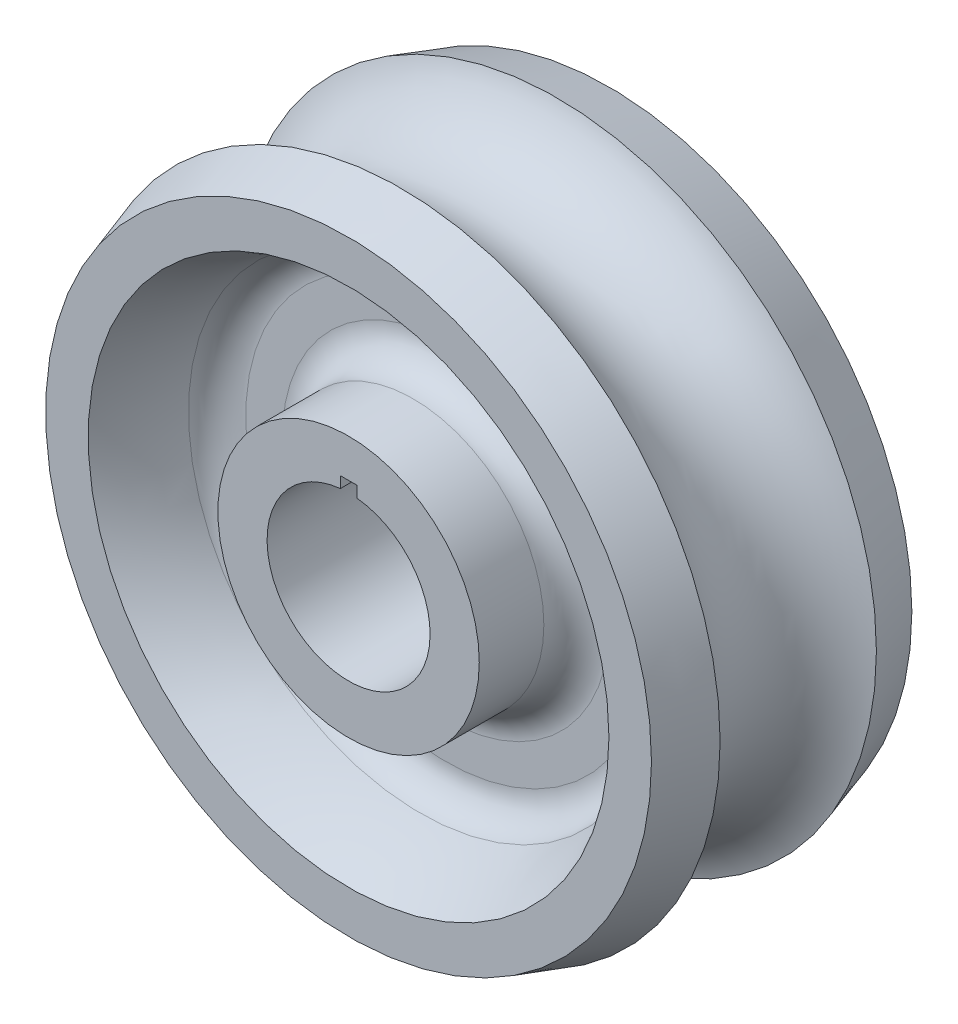
from build123d import *

# Parameters (mm, degrees)
CUT_EXTRUDE1_DEPTH = 51.874601802


with BuildPart() as part:
    # Sketch1 → Base-Revolve (revolve)
    with BuildSketch(Plane(origin=(0, 0, 0), x_dir=(0, 0, -1), z_dir=(1, 0, 0))):
        with BuildLine():
            Line((-12.7, 7.95), (12.7, 7.95))
            Line((12.7, 7.95), (12.7, 12.75))
            Line((12.7, 12.75), (6.4, 12.75))
            ThreePointArc((6.4, 12.75), (4.1372583, 13.6872583), (3.2, 15.95))
            Line((3.2, 15.95), (3.2, 19.522325527))
            ThreePointArc((3.2, 19.522325527), (3.896855125, 21.515881579), (5.683916084, 22.641175287))
            ThreePointArc((5.683916084, 22.641175287), (9.294884136, 23.758831937), (12.7, 25.4))
            Line((12.7, 25.4), (12.7, 29.55))
            Line((12.7, 29.55), (7.621828267, 31.16941697))
            ThreePointArc((7.621828267, 31.16941697), (0, 25.6), (-7.621828267, 31.16941697))
            Line((-7.621828267, 31.16941697), (-12.7, 29.55))
            Line((-12.7, 29.55), (-12.7, 25.4))
            ThreePointArc((-12.7, 25.4), (-9.294884136, 23.758831937), (-5.683916084, 22.641175287))
            ThreePointArc((-5.683916084, 22.641175287), (-3.896855125, 21.515881579), (-3.2, 19.522325527))
            Line((-3.2, 19.522325527), (-3.2, 15.95))
            ThreePointArc((-3.2, 15.95), (-4.1372583, 13.6872583), (-6.4, 12.75))
            Line((-6.4, 12.75), (-12.7, 12.75))
            Line((-12.7, 12.75), (-12.7, 7.95))
        make_face()
    revolve(axis=Axis((0, 0, 0), (0, 0, -1)))

    # Sketch2 → Cut-Extrude1 (cut, through all)
    with BuildSketch(Plane.XY.offset(12.7)):
        with BuildLine():
            Line((-0.8, 7.90964601), (-0.8, 9))
            Line((-0.8, 9), (0.8, 9))
            Line((0.8, 9), (0.8, 7.90964601))
            ThreePointArc((0.8, 7.90964601), (0, 7.95), (-0.8, 7.90964601))
        make_face()
    extrude(amount=-CUT_EXTRUDE1_DEPTH, mode=Mode.SUBTRACT)


solid = part.part
